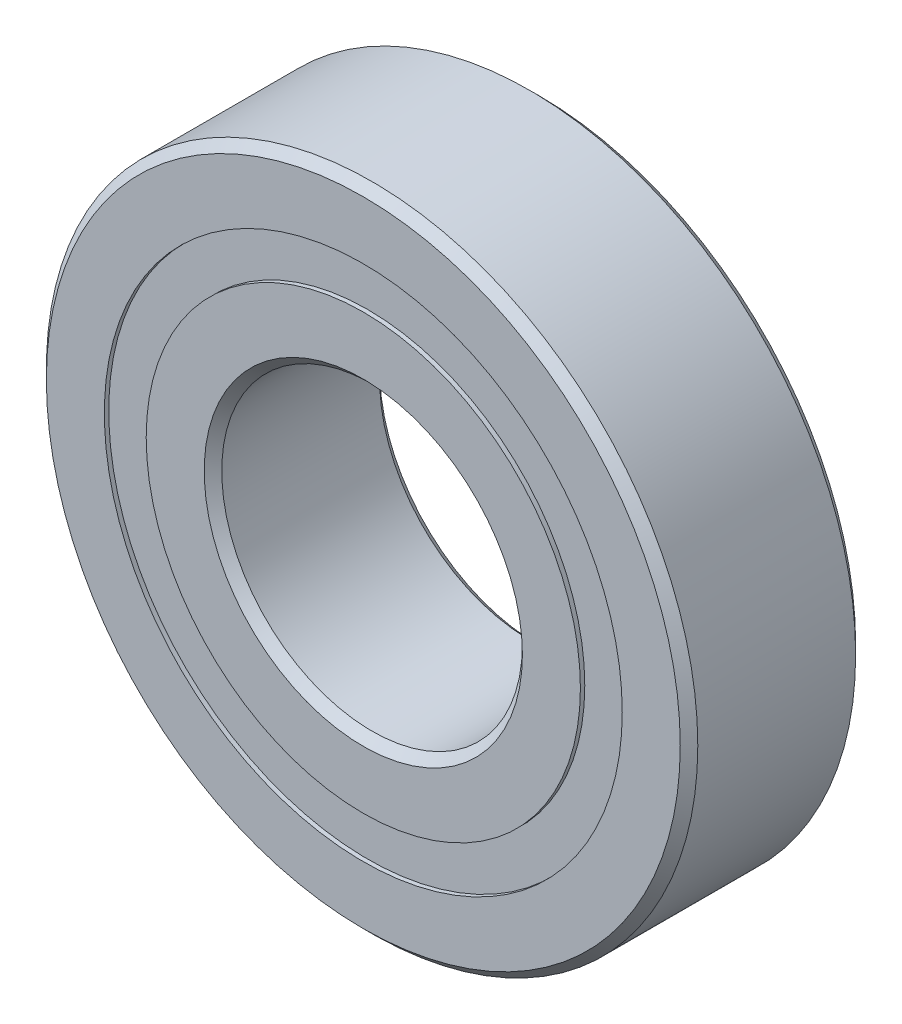
from build123d import *

# Parameters (mm, degrees)
CIRPATTERN1_COUNT = 12
SKETCH5_W         = 2.475587948
SKETCH5_H         = 2.651648352


with BuildPart() as part:
    # Sketch1 → Revolve1 (revolve)
    with BuildSketch(Plane(origin=(0, 0, 0), x_dir=(0, 0, -1), z_dir=(1, 0, 0))):
        with BuildLine():
            Line((5.000625, 20.6375), (-5.000625, 20.6375))
            Line((-5.000625, 20.6375), (-5.55625, 20.081875))
            Line((-5.55625, 20.081875), (-5.55625, 16.407074176))
            Line((-5.55625, 16.407074176), (-2.469444444, 16.407074176))
            ThreePointArc((-2.469444444, 16.407074176), (0, 17.884099552), (2.469444444, 16.407074176))
            Line((2.469444444, 16.407074176), (5.55625, 16.407074176))
            Line((5.55625, 16.407074176), (5.55625, 20.081875))
            Line((5.55625, 20.081875), (5.000625, 20.6375))
        make_face()
    revolve(axis=Axis((0, 0, 5.55625), (0, 0, -1)))


with BuildPart() as body_2:
    # Sketch3 → Revolve3 (revolve)
    with BuildSketch(Plane(origin=(0, 0, 0), x_dir=(0, 0, -1), z_dir=(1, 0, 0))):
        with BuildLine():
            Line((-5.55625, 13.755425824), (-2.469444444, 13.755425824))
            ThreePointArc((-2.469444444, 13.755425824), (0, 12.278400448), (2.469444444, 13.755425824))
            Line((2.469444444, 13.755425824), (5.55625, 13.755425824))
            Line((5.55625, 13.755425824), (5.55625, 10.080625))
            Line((5.55625, 10.080625), (5.000625, 9.525))
            Line((5.000625, 9.525), (-5.000625, 9.525))
            Line((-5.000625, 9.525), (-5.55625, 10.080625))
            Line((-5.55625, 10.080625), (-5.55625, 13.755425824))
        make_face()
    revolve(axis=Axis((0, 0, 5.55625), (0, 0, -1)))


with BuildPart() as body_3:
    # Sketch4 → Revolve4 (revolve)
    with BuildSketch(Plane(origin=(0, 0, 0), x_dir=(0, 0, -1), z_dir=(1, 0, 0))):
        with BuildLine():
            Line((-2.802849552, 15.08125), (2.802849552, 15.08125))
            ThreePointArc((2.802849552, 15.08125), (0, 17.884099552), (-2.802849552, 15.08125))
        make_face()
    revolve(axis=Axis((0, 15.08125, 2.802849552), (0, 0, -1)))


with BuildPart() as cirpattern1_1:
    # CirPattern1: pattern copy
    add(body_3.part.rotate(Axis((0, 0, -5.55625), (0, 0, 1)), 1 * 360 / CIRPATTERN1_COUNT))


with BuildPart() as cirpattern1_2:
    # CirPattern1: pattern copy
    add(body_3.part.rotate(Axis((0, 0, -5.55625), (0, 0, 1)), 2 * 360 / CIRPATTERN1_COUNT))


with BuildPart() as cirpattern1_3:
    # CirPattern1: pattern copy
    add(body_3.part.rotate(Axis((0, 0, -5.55625), (0, 0, 1)), 3 * 360 / CIRPATTERN1_COUNT))


with BuildPart() as cirpattern1_4:
    # CirPattern1: pattern copy
    add(body_3.part.rotate(Axis((0, 0, -5.55625), (0, 0, 1)), 4 * 360 / CIRPATTERN1_COUNT))


with BuildPart() as cirpattern1_5:
    # CirPattern1: pattern copy
    add(body_3.part.rotate(Axis((0, 0, -5.55625), (0, 0, 1)), 5 * 360 / CIRPATTERN1_COUNT))


with BuildPart() as cirpattern1_6:
    # CirPattern1: pattern copy
    add(body_3.part.rotate(Axis((0, 0, -5.55625), (0, 0, 1)), 6 * 360 / CIRPATTERN1_COUNT))


with BuildPart() as cirpattern1_7:
    # CirPattern1: pattern copy
    add(body_3.part.rotate(Axis((0, 0, -5.55625), (0, 0, 1)), 7 * 360 / CIRPATTERN1_COUNT))


with BuildPart() as cirpattern1_8:
    # CirPattern1: pattern copy
    add(body_3.part.rotate(Axis((0, 0, -5.55625), (0, 0, 1)), 8 * 360 / CIRPATTERN1_COUNT))


with BuildPart() as cirpattern1_9:
    # CirPattern1: pattern copy
    add(body_3.part.rotate(Axis((0, 0, -5.55625), (0, 0, 1)), 9 * 360 / CIRPATTERN1_COUNT))


with BuildPart() as cirpattern1_10:
    # CirPattern1: pattern copy
    add(body_3.part.rotate(Axis((0, 0, -5.55625), (0, 0, 1)), 10 * 360 / CIRPATTERN1_COUNT))


with BuildPart() as cirpattern1_11:
    # CirPattern1: pattern copy
    add(body_3.part.rotate(Axis((0, 0, -5.55625), (0, 0, 1)), 11 * 360 / CIRPATTERN1_COUNT))


with BuildPart() as body_15:
    # Sketch5 → Revolve5 (revolve)
    with BuildSketch(Plane(origin=(0, 0, 0), x_dir=(0, 0, -1), z_dir=(1, 0, 0))):
        with Locations((-4.040643526, 15.08125)):
            Rectangle(SKETCH5_W, SKETCH5_H)
        with Locations((4.040643526, 15.08125)):
            Rectangle(SKETCH5_W, SKETCH5_H)
    revolve(axis=Axis((0, 0, 5.55625), (0, 0, -1)))


solid = Compound([part.part, body_2.part, body_3.part, cirpattern1_1.part, cirpattern1_2.part, cirpattern1_3.part, cirpattern1_4.part, cirpattern1_5.part, cirpattern1_6.part, cirpattern1_7.part, cirpattern1_8.part, cirpattern1_9.part, cirpattern1_10.part, cirpattern1_11.part, body_15.part])
